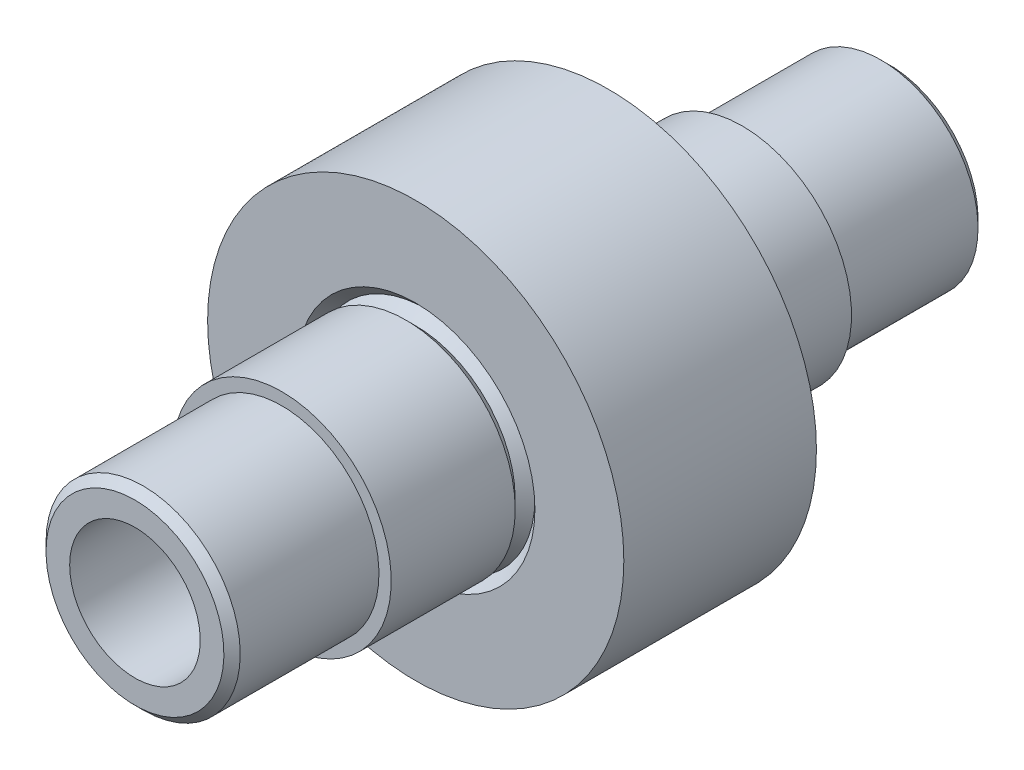
from build123d import *

# Parameters (mm, degrees)
SKETCH_2_R          = 1.5
CUT_EXTRUDE_1_DEPTH = 36.114099732
SKETCH_4_R          = 14
SKETCH_4_R_2        = 12.75
CUT_EXTRUDE_4_DEPTH = 36.114099732
CUT_EXTRUDE_5_DEPTH = 35.148572445
SKETCH_6_R          = 4
CUT_EXTRUDE_6_DEPTH = 50.594001653
SKETCH_7_R          = 12.75
SKETCH_7_R_2        = 6.7
EXTRUDE_1_DEPTH     = 11.8
CHAMFER_1_SIZE      = 0.5


with BuildPart() as part:
    # 草图1 → 旋转1 (revolve)
    with BuildSketch(Plane(origin=(0, 0, 0), x_dir=(0, 0, -1), z_dir=(1, 0, 0)), mode=Mode.PRIVATE) as revolve_1_sk:
        Polygon((-23.1, 0), (-23.1, 5.95), (-14.1, 5.95), (-14.1, 6.7), (-5.9, 6.7), (-5.9, 14), (5.9, 14), (5.9, 6.7), (14.1, 6.7), (14.1, 5.95), (23.1, 5.95), (23.1, 0), align=None)
    revolve(revolve_1_sk.sketch.rotate(Axis((0, 0, 23.1), (0, 0, -1)), 180), axis=Axis((0, 0, 23.1), (0, 0, -1)))

    # 草图2 → 切除-拉伸1 (cut, through all)
    with BuildSketch(Plane.XY.offset(5.9)):
        with Locations((0, 10.5)):
            Circle(SKETCH_2_R)
        with Locations((10.5, 0)):
            Circle(SKETCH_2_R)
        with Locations((0, -10.5)):
            Circle(SKETCH_2_R)
        with Locations((-10.5, 0)):
            Circle(SKETCH_2_R)
    extrude(amount=-CUT_EXTRUDE_1_DEPTH, mode=Mode.SUBTRACT)

    # 草图4 → 切除-拉伸4 (cut, through all)
    with BuildSketch(Plane(origin=(0, 0, -5.9), x_dir=(-1, 0, 0), z_dir=(0, 0, -1))):
        Circle(SKETCH_4_R)
        Circle(SKETCH_4_R_2, mode=Mode.SUBTRACT)
    extrude(amount=-CUT_EXTRUDE_4_DEPTH, mode=Mode.SUBTRACT)

    # 草图5 → 切除-拉伸5 (cut, through all)
    with BuildSketch(Plane(origin=(0, 0, -5.9), x_dir=(-1, 0, 0), z_dir=(0, 0, -1))):
        with BuildLine():
            Line((-9.26871571, 3.618136135), (-8.331955809, 3.252462513))
            ThreePointArc((-8.331955809, 3.252462513), (-7.618330669, 3.247249598), (-7.082950618, 3.719114215))
            ThreePointArc((-7.082950618, 3.719114215), (-5.656854249, 5.656854249), (-3.719114215, 7.082950618))
            ThreePointArc((-3.719114215, 7.082950618), (-3.247249598, 7.618330669), (-3.252462513, 8.331955809))
            Line((-3.252462513, 8.331955809), (-3.618136135, 9.26871571))
            ThreePointArc((-3.618136135, 9.26871571), (-4.194460373, 9.839863314), (-5.004644825, 9.795587281))
            ThreePointArc((-5.004644825, 9.795587281), (-7.778174593, 7.778174593), (-9.795587281, 5.004644825))
            ThreePointArc((-9.795587281, 5.004644825), (-9.839863314, 4.194460373), (-9.26871571, 3.618136135))
        make_face()
        with BuildLine():
            Line((3.618136135, 9.26871571), (3.252462513, 8.331955809))
            ThreePointArc((3.252462513, 8.331955809), (3.247249598, 7.618330669), (3.719114215, 7.082950618))
            ThreePointArc((3.719114215, 7.082950618), (5.656854249, 5.656854249), (7.082950618, 3.719114215))
            ThreePointArc((7.082950618, 3.719114215), (7.618330669, 3.247249598), (8.331955809, 3.252462513))
            Line((8.331955809, 3.252462513), (9.26871571, 3.618136135))
            ThreePointArc((9.26871571, 3.618136135), (9.839863314, 4.194460373), (9.795587281, 5.004644825))
            ThreePointArc((9.795587281, 5.004644825), (7.778174593, 7.778174593), (5.004644825, 9.795587281))
            ThreePointArc((5.004644825, 9.795587281), (4.194460373, 9.839863314), (3.618136135, 9.26871571))
        make_face()
        with BuildLine():
            Line((9.26871571, -3.618136135), (8.331955809, -3.252462513))
            ThreePointArc((8.331955809, -3.252462513), (7.618330669, -3.247249598), (7.082950618, -3.719114215))
            ThreePointArc((7.082950618, -3.719114215), (5.656854249, -5.656854249), (3.719114215, -7.082950618))
            ThreePointArc((3.719114215, -7.082950618), (3.247249598, -7.618330669), (3.252462513, -8.331955809))
            Line((3.252462513, -8.331955809), (3.618136135, -9.26871571))
            ThreePointArc((3.618136135, -9.26871571), (4.194460373, -9.839863314), (5.004644825, -9.795587281))
            ThreePointArc((5.004644825, -9.795587281), (7.778174593, -7.778174593), (9.795587281, -5.004644825))
            ThreePointArc((9.795587281, -5.004644825), (9.839863314, -4.194460373), (9.26871571, -3.618136135))
        make_face()
        with BuildLine():
            Line((-3.618136135, -9.26871571), (-3.252462513, -8.331955809))
            ThreePointArc((-3.252462513, -8.331955809), (-3.247249598, -7.618330669), (-3.719114215, -7.082950618))
            ThreePointArc((-3.719114215, -7.082950618), (-5.656854249, -5.656854249), (-7.082950618, -3.719114215))
            ThreePointArc((-7.082950618, -3.719114215), (-7.618330669, -3.247249598), (-8.331955809, -3.252462513))
            Line((-8.331955809, -3.252462513), (-9.26871571, -3.618136135))
            ThreePointArc((-9.26871571, -3.618136135), (-9.839863314, -4.194460373), (-9.795587281, -5.004644825))
            ThreePointArc((-9.795587281, -5.004644825), (-7.778174593, -7.778174593), (-5.004644825, -9.795587281))
            ThreePointArc((-5.004644825, -9.795587281), (-4.194460373, -9.839863314), (-3.618136135, -9.26871571))
        make_face()
    extrude(amount=-CUT_EXTRUDE_5_DEPTH, mode=Mode.SUBTRACT)

    # 草图6 → 切除-拉伸6 (cut, through all)
    with BuildSketch(Plane(origin=(0, 0, -23.1), x_dir=(-1, 0, 0), z_dir=(0, 0, -1))):
        Circle(SKETCH_6_R)
    extrude(amount=-CUT_EXTRUDE_6_DEPTH, mode=Mode.SUBTRACT)

    # 草图7 → 凸台-拉伸1 (add)
    with BuildSketch(Plane(origin=(0, 0, -5.9), x_dir=(-1, 0, 0), z_dir=(0, 0, -1))):
        Circle(SKETCH_7_R)
        with Locations(Location((0, 0, 0), (0, 0, 270))):
            Circle(SKETCH_7_R_2, mode=Mode.SUBTRACT)
    extrude(amount=-EXTRUDE_1_DEPTH)

    # 草图8 → 切除-旋转1 (revolve, cut)
    with BuildSketch(Plane(origin=(0, 0, 0), x_dir=(0, 0, -1), z_dir=(1, 0, 0)), mode=Mode.PRIVATE) as cut_revolve_1_sk:
        Polygon((-6.502145005, 6.7), (-5.9, 6.093231234), (-5.294771168, 6.7), (-5.9, 7.303692806), align=None)
        Polygon((6.502145005, 6.7), (5.9, 7.303692806), (5.294771168, 6.7), (5.9, 6.093231234), align=None)
    revolve(cut_revolve_1_sk.sketch.rotate(Axis((0, 0, 0), (0, 0, -1)), 90), axis=Axis((0, 0, 0), (0, 0, -1)), mode=Mode.SUBTRACT)

    # 倒角1
    chamfer_1_edges = [part.edges().sort_by_distance(p)[0] for p in [
        (0, 5.95, -23.1),
        (0, 5.95, 23.1),
    ]]
    chamfer(chamfer_1_edges, length=CHAMFER_1_SIZE)


solid = part.part
